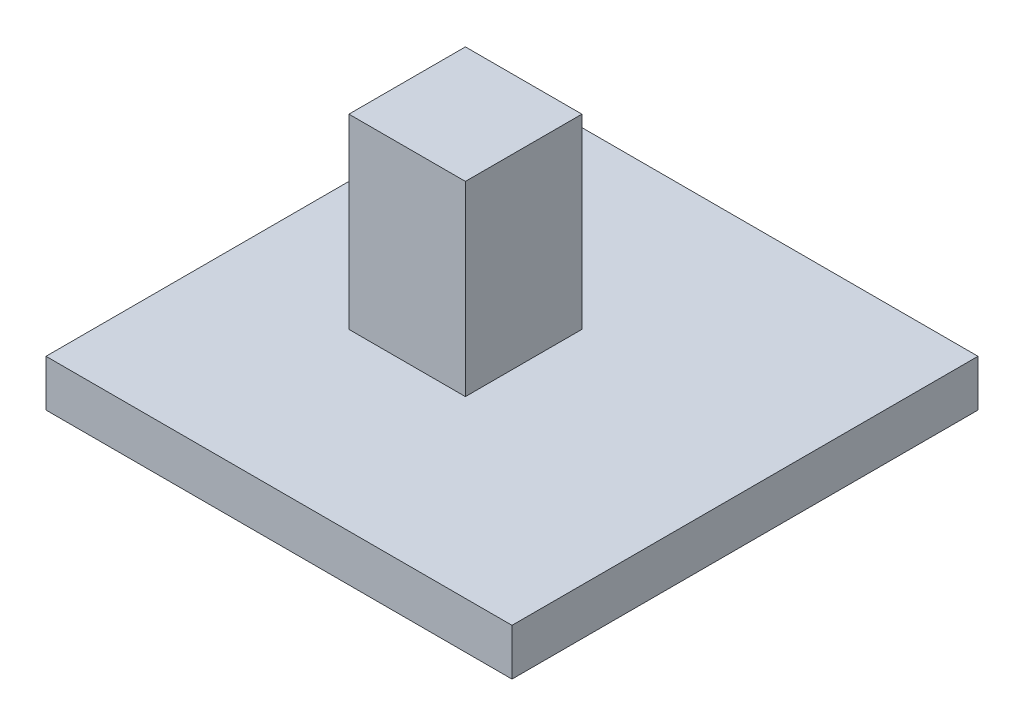
from build123d import *

# Parameters (mm, degrees)
SKETCH_1_W      = 200
SKETCH_1_H      = 200
EXTRUDE_1_DEPTH = 20
SKETCH_2_W      = 50
SKETCH_2_H      = 50
EXTRUDE_2_DEPTH = 80


with BuildPart() as part:
    # 草图1 → 凸台-拉伸1 (new body)
    with BuildSketch(Plane(origin=(0, 0, 0), x_dir=(1, 0, 0), z_dir=(0, 1, 0))):
        Rectangle(SKETCH_1_W, SKETCH_1_H)
    extrude(amount=EXTRUDE_1_DEPTH)

    # 草图2 → 凸台-拉伸2 (add)
    with BuildSketch(Plane(origin=(0, 20, 0), x_dir=(1, 0, 0), z_dir=(0, 1, 0))):
        with Locations((-20, 0)):
            Rectangle(SKETCH_2_W, SKETCH_2_H)
    extrude(amount=EXTRUDE_2_DEPTH)


solid = part.part
